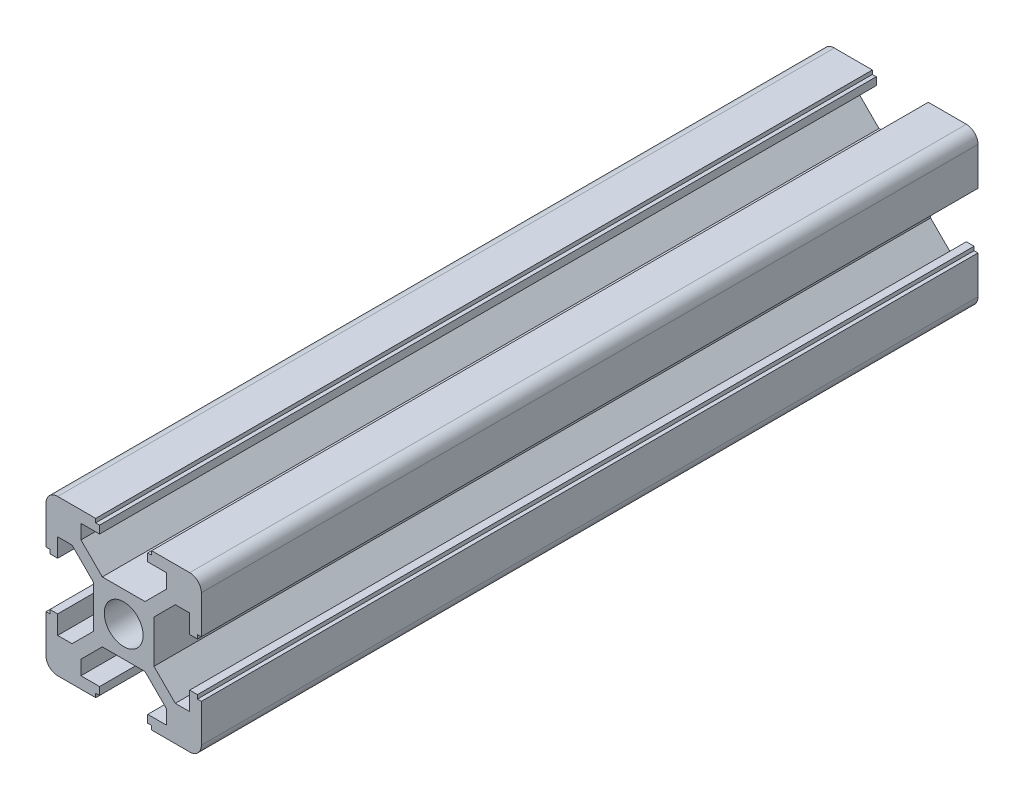
from build123d import *

# Parameters (mm, degrees)
SKETCH1_R                = 2.5
F_20_X_20_X_R1_5_1_DEPTH = 100


with BuildPart() as part:
    # Sketch1 → 铝型材 20 X 20 X R1.5(1) (new body)
    with BuildSketch(Plane.YX):
        with BuildLine():
            Line((-3.6, 10), (-3.6, 9.5))
            Line((-3.6, 9.5), (-3.1, 9.5))
            Line((-3.1, 9.5), (-3.1, 8.5))
            Line((-3.1, 8.5), (-5.5, 8.5))
            Line((-5.5, 8.5), (-5.5, 6.65))
            Line((-5.5, 6.65), (-2.75, 3.9))
            Line((-2.75, 3.9), (2.75, 3.9))
            Line((2.75, 3.9), (5.5, 6.65))
            Line((5.5, 6.65), (5.5, 8.5))
            Line((5.5, 8.5), (3.1, 8.5))
            Line((3.1, 8.5), (3.1, 9.5))
            Line((3.1, 9.5), (3.6, 9.5))
            Line((3.6, 9.5), (3.6, 10))
            Line((3.6, 10), (8.5, 10))
            ThreePointArc((8.5, 10), (9.560660172, 9.560660172), (10, 8.5))
            Line((10, 8.5), (10, 3.6))
            Line((10, 3.6), (9.5, 3.6))
            Line((9.5, 3.6), (9.5, 3.1))
            Line((9.5, 3.1), (8.5, 3.1))
            Line((8.5, 3.1), (8.5, 5.5))
            Line((8.5, 5.5), (6.65, 5.5))
            Line((6.65, 5.5), (3.9, 2.75))
            Line((3.9, 2.75), (3.9, -2.75))
            Line((3.9, -2.75), (6.65, -5.5))
            Line((6.65, -5.5), (8.5, -5.5))
            Line((8.5, -5.5), (8.5, -3.1))
            Line((8.5, -3.1), (9.5, -3.1))
            Line((9.5, -3.1), (9.5, -3.6))
            Line((9.5, -3.6), (10, -3.6))
            Line((10, -3.6), (10, -8.5))
            ThreePointArc((10, -8.5), (9.560660172, -9.560660172), (8.5, -10))
            Line((8.5, -10), (3.6, -10))
            Line((3.6, -10), (3.6, -9.5))
            Line((3.6, -9.5), (3.1, -9.5))
            Line((3.1, -9.5), (3.1, -8.5))
            Line((3.1, -8.5), (5.5, -8.5))
            Line((5.5, -8.5), (5.5, -6.65))
            Line((5.5, -6.65), (2.75, -3.9))
            Line((2.75, -3.9), (-2.75, -3.9))
            Line((-2.75, -3.9), (-5.5, -6.65))
            Line((-5.5, -6.65), (-5.5, -8.5))
            Line((-5.5, -8.5), (-3.1, -8.5))
            Line((-3.1, -8.5), (-3.1, -9.5))
            Line((-3.1, -9.5), (-3.6, -9.5))
            Line((-3.6, -9.5), (-3.6, -10))
            Line((-3.6, -10), (-8.5, -10))
            ThreePointArc((-8.5, -10), (-9.560660172, -9.560660172), (-10, -8.5))
            Line((-10, -8.5), (-10, -3.6))
            Line((-10, -3.6), (-9.5, -3.6))
            Line((-9.5, -3.6), (-9.5, -3.1))
            Line((-9.5, -3.1), (-8.5, -3.1))
            Line((-8.5, -3.1), (-8.5, -5.5))
            Line((-8.5, -5.5), (-6.65, -5.5))
            Line((-6.65, -5.5), (-3.9, -2.75))
            Line((-3.9, -2.75), (-3.9, 2.75))
            Line((-3.9, 2.75), (-6.65, 5.5))
            Line((-6.65, 5.5), (-8.5, 5.5))
            Line((-8.5, 5.5), (-8.5, 3.1))
            Line((-8.5, 3.1), (-9.5, 3.1))
            Line((-9.5, 3.1), (-9.5, 3.6))
            Line((-9.5, 3.6), (-10, 3.6))
            Line((-10, 3.6), (-10, 8.5))
            ThreePointArc((-10, 8.5), (-9.560660172, 9.560660172), (-8.5, 10))
            Line((-8.5, 10), (-3.6, 10))
        make_face()
        Circle(SKETCH1_R, mode=Mode.SUBTRACT)
    extrude(amount=F_20_X_20_X_R1_5_1_DEPTH)


solid = part.part
